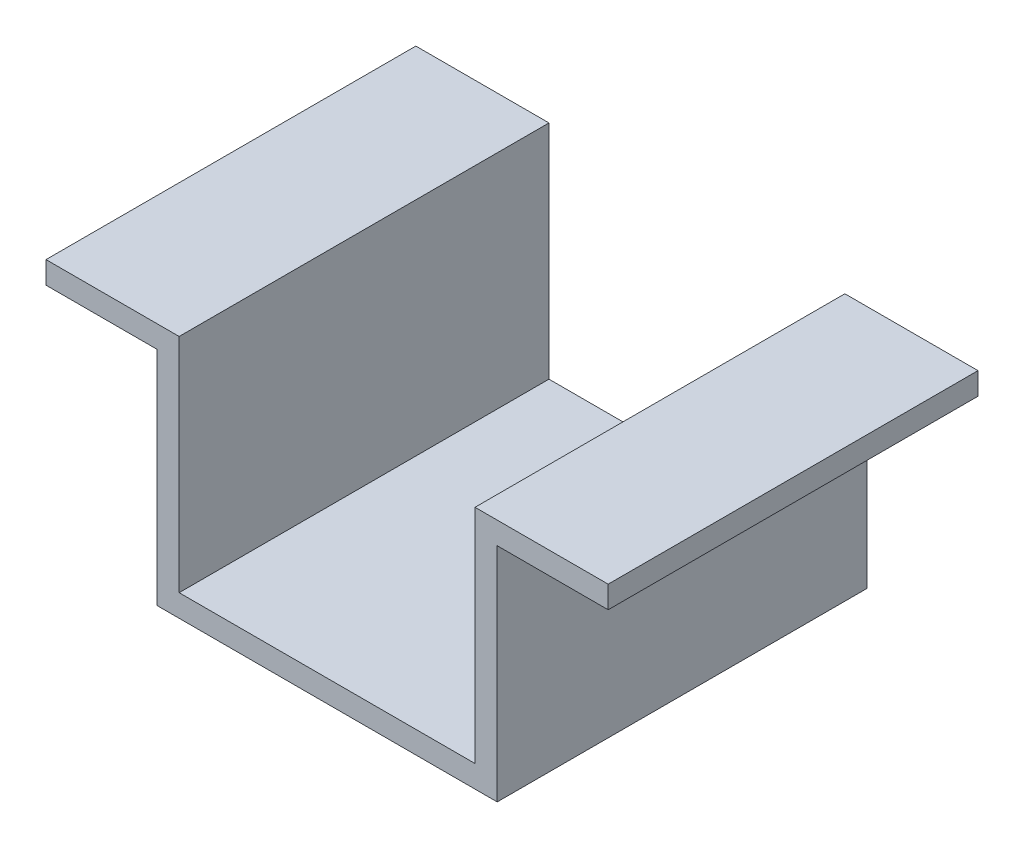
from build123d import *

# Parameters (mm, degrees)
BOSS_EXTRUDE1_DEPTH = 25


with BuildPart() as part:
    # Sketch1 → Boss-Extrude1 (new body)
    with BuildSketch(Plane.XY):
        Polygon((11.5, 38.091175636), (11.5, 23.091175636), (-11.5, 23.091175636), (-11.5, 38.091175636), (-19, 38.091175636), (-19, 39.591175636), (-10, 39.591175636), (-10, 24.591175636), (10, 24.591175636), (10, 39.591175636), (19, 39.591175636), (19, 38.091175636), align=None)
    extrude(amount=BOSS_EXTRUDE1_DEPTH)


solid = part.part
